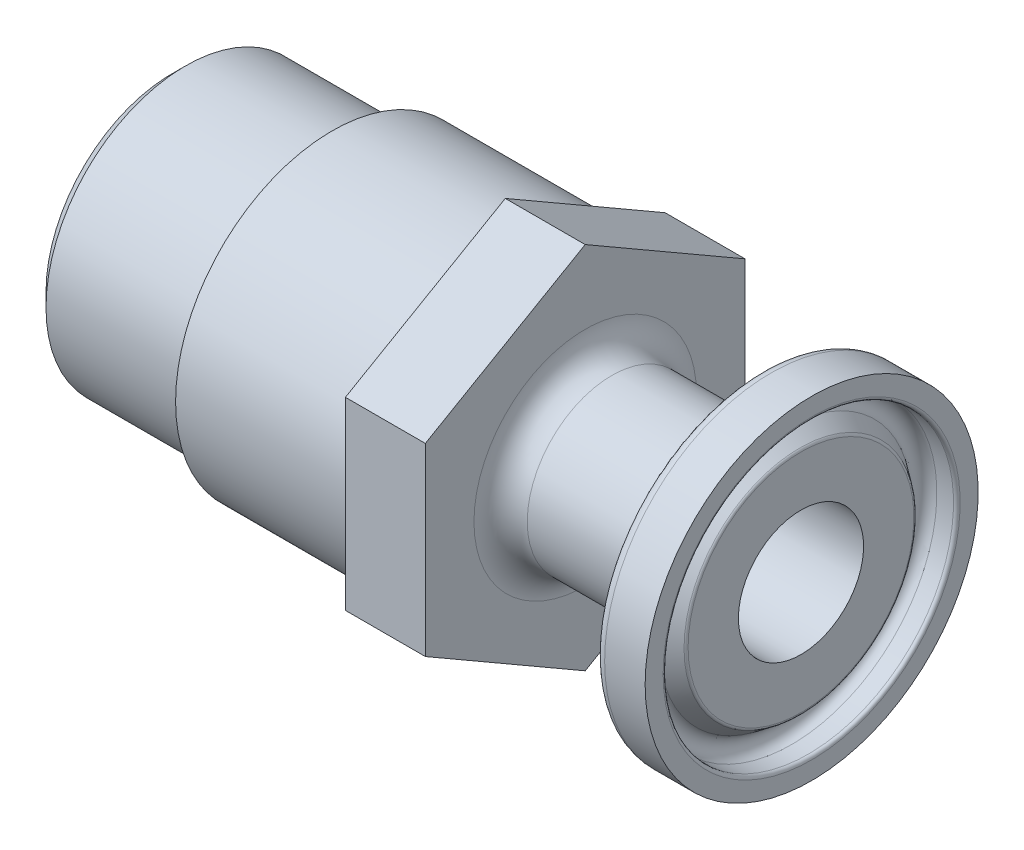
from build123d import *

# Parameters (mm, degrees)
SCHNITT_LINEAR_START            = -38
SKIZZE2_R                       = 15
SCHNITT_LINEAR_AUSTRAGEN1_DEPTH = 38


with BuildPart() as part:
    # Skizze1 → Rotation1 (revolve)
    with BuildSketch(Plane.XY, mode=Mode.PRIVATE) as rotation1_sk:
        with BuildLine():
            Line((47.75, 10.9), (46.5, 10.9))
            ThreePointArc((46.5, 10.9), (45.739154787, 10.347213595), (46.029771798, 9.452786405))
            Line((46.029771798, 9.452786405), (47.096946313, 8.677438735))
            ThreePointArc((47.096946313, 8.677438735), (47.172751631, 8.588682111), (47.2, 8.475184486))
            Line((47.2, 8.475184486), (47.2, 4.7))
            Line((47.2, 4.7), (0, 4.7))
            Line((0, 4.7), (0, 9.4775))
            Line((0, 9.4775), (1, 10.4775))
            Line((1, 10.4775), (11.5, 10.4775))
            ThreePointArc((11.5, 10.4775), (11.853553391, 10.623946609), (12, 10.9775))
            Line((12, 10.9775), (12, 11.75))
            Line((12, 11.75), (25, 11.75))
            Line((25, 11.75), (25, 15))
            Line((25, 15), (31, 15))
            Line((31, 15), (31, 8.35))
            ThreePointArc((31, 8.35), (31.585786438, 6.935786438), (33, 6.35))
            Line((33, 6.35), (40.761167983, 6.35))
            ThreePointArc((40.761167983, 6.35), (41.908320856, 6.711695911), (42.640553224, 7.665959713))
            Line((42.640553224, 7.665959713), (44.208411934, 11.973616115))
            ThreePointArc((44.208411934, 11.973616115), (44.501304881, 12.355321635), (44.960166031, 12.5))
            Line((44.960166031, 12.5), (48, 12.5))
            Line((48, 12.5), (48, 11.15))
            ThreePointArc((48, 11.15), (47.926776695, 10.973223305), (47.75, 10.9))
        make_face()
    revolve(rotation1_sk.sketch.rotate(Axis((0, 0, 0), (1, 0, 0)), 90), axis=Axis((0, 0, 0), (1, 0, 0)))

    # Skizze2 → Schnitt-Linear austragen1 (cut)
    with BuildSketch(Plane.ZY.offset(SCHNITT_LINEAR_START)):
        Circle(SKIZZE2_R)
        Polygon((-12, -6.92820323), (0, -13.856406461), (12, -6.92820323), (12, 6.92820323), (0, 13.856406461), (-12, 6.92820323), align=None, mode=Mode.SUBTRACT)
    extrude(amount=SCHNITT_LINEAR_AUSTRAGEN1_DEPTH, mode=Mode.SUBTRACT)


solid = part.part
